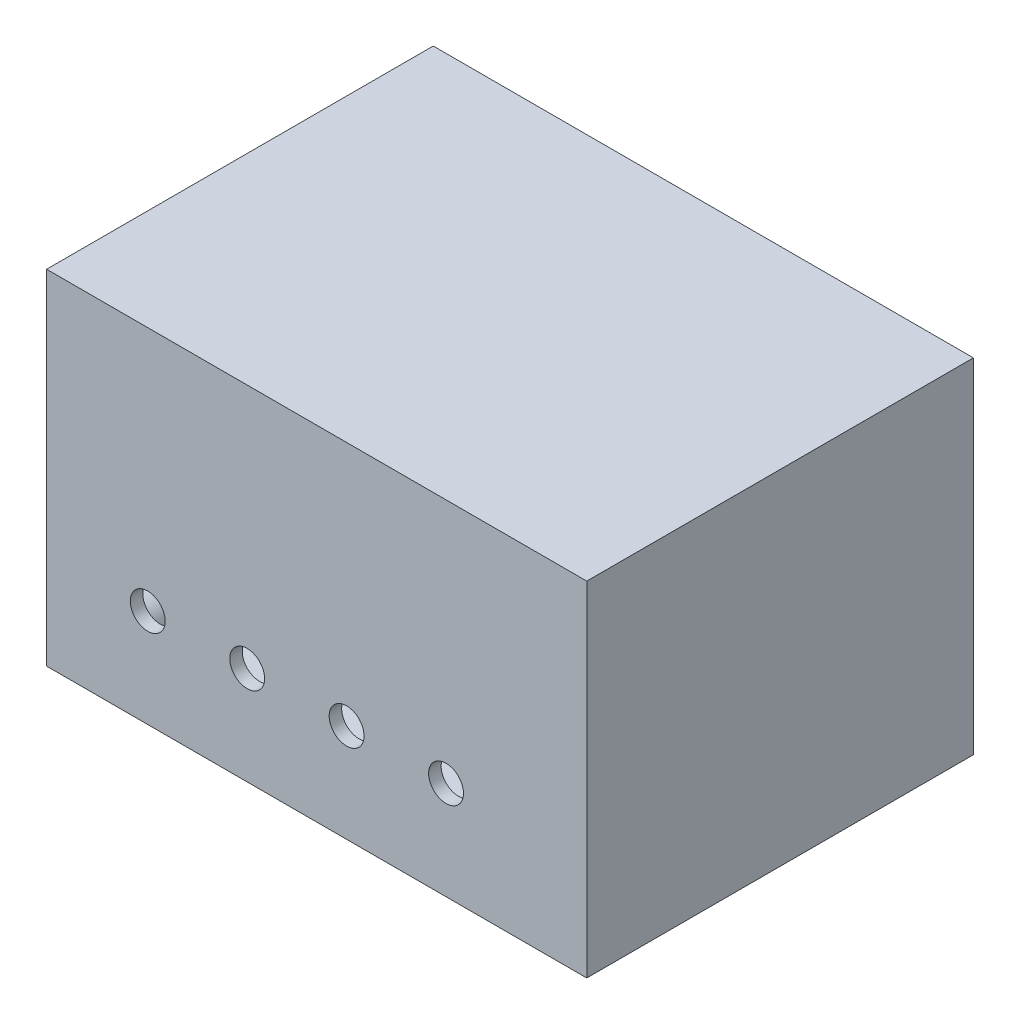
from build123d import *

# Parameters (mm, degrees)
SKETCH1_W           = 110
SKETCH1_H           = 70
BOSS_EXTRUDE1_DEPTH = 2.54
SKETCH4_W           = 110
SKETCH4_H           = 70
SKETCH4_W_2         = 105
SKETCH4_H_2         = 65
BOSS_EXTRUDE3_DEPTH = 76.2
SKETCH7_R           = 5.31
SKETCH7_R_2         = 2.77
BOSS_EXTRUDE5_DEPTH = 10
SKETCH9_R           = 3.55
CUT_EXTRUDE1_DEPTH  = 2.54


with BuildPart() as part:
    # Sketch1 → Boss-Extrude1 (new body)
    with BuildSketch(Plane.XY):
        with Locations((-3.180803055, -7.420155336)):
            Rectangle(SKETCH1_W, SKETCH1_H)
    extrude(amount=BOSS_EXTRUDE1_DEPTH)

    # Sketch4 → Boss-Extrude3 (add)
    with BuildSketch(Plane(origin=(0, 0, 0), x_dir=(-1, 0, 0), z_dir=(0, 0, -1))):
        with Locations((3.180803055, -7.420155336)):
            Rectangle(SKETCH4_W, SKETCH4_H)
        with Locations((3.180803055, -7.420155336)):
            Rectangle(SKETCH4_W_2, SKETCH4_H_2, mode=Mode.SUBTRACT)
    extrude(amount=BOSS_EXTRUDE3_DEPTH)

    # Sketch7 → Boss-Extrude5 (add)
    # profile 1 of 4: a face of its own
    with BuildSketch(Plane(origin=(0, 0, 0), x_dir=(-1, 0, 0), z_dir=(0, 0, -1))):
        with Locations(Location((-43.819196945, 17.579844664, 0), (0, 0, 180))):
            Circle(SKETCH7_R)
        with Locations((-43.819196945, 17.579844664)):
            Circle(SKETCH7_R_2, mode=Mode.SUBTRACT)
    # profile 2 of 4: a face of its own
    with BuildSketch(Plane(origin=(0, 0, 0), x_dir=(-1, 0, 0), z_dir=(0, 0, -1))):
        with Locations(Location((47.180803055, 17.579844664, 0), (0, 0, 180))):
            Circle(SKETCH7_R)
        with Locations((47.180803055, 17.579844664)):
            Circle(SKETCH7_R_2, mode=Mode.SUBTRACT)
    # profile 3 of 4: a face of its own
    with BuildSketch(Plane(origin=(0, 0, 0), x_dir=(-1, 0, 0), z_dir=(0, 0, -1))):
        with Locations(Location((47.180803055, -32.420155336, 0), (0, 0, 180))):
            Circle(SKETCH7_R)
        with Locations((47.180803055, -32.420155336)):
            Circle(SKETCH7_R_2, mode=Mode.SUBTRACT)
    # profile 4 of 4: a face of its own
    with BuildSketch(Plane(origin=(0, 0, 0), x_dir=(-1, 0, 0), z_dir=(0, 0, -1))):
        with Locations(Location((-43.819196945, -32.420155336, 0), (0, 0, 180))):
            Circle(SKETCH7_R)
        with Locations((-43.819196945, -32.420155336)):
            Circle(SKETCH7_R_2, mode=Mode.SUBTRACT)
    extrude(amount=BOSS_EXTRUDE5_DEPTH)

    # Sketch9 → Cut-Extrude1 (cut)
    with BuildSketch(Plane.XY.offset(2.54)):
        with Locations((23.169196945, -22.420155336)):
            Circle(SKETCH9_R)
        with Locations((2.919196945, -22.420155336)):
            Circle(SKETCH9_R)
        with Locations((-17.330803055, -22.420155336)):
            Circle(SKETCH9_R)
        with Locations((-37.580803055, -22.420155336)):
            Circle(SKETCH9_R)
    extrude(amount=-CUT_EXTRUDE1_DEPTH, mode=Mode.SUBTRACT)


solid = part.part
